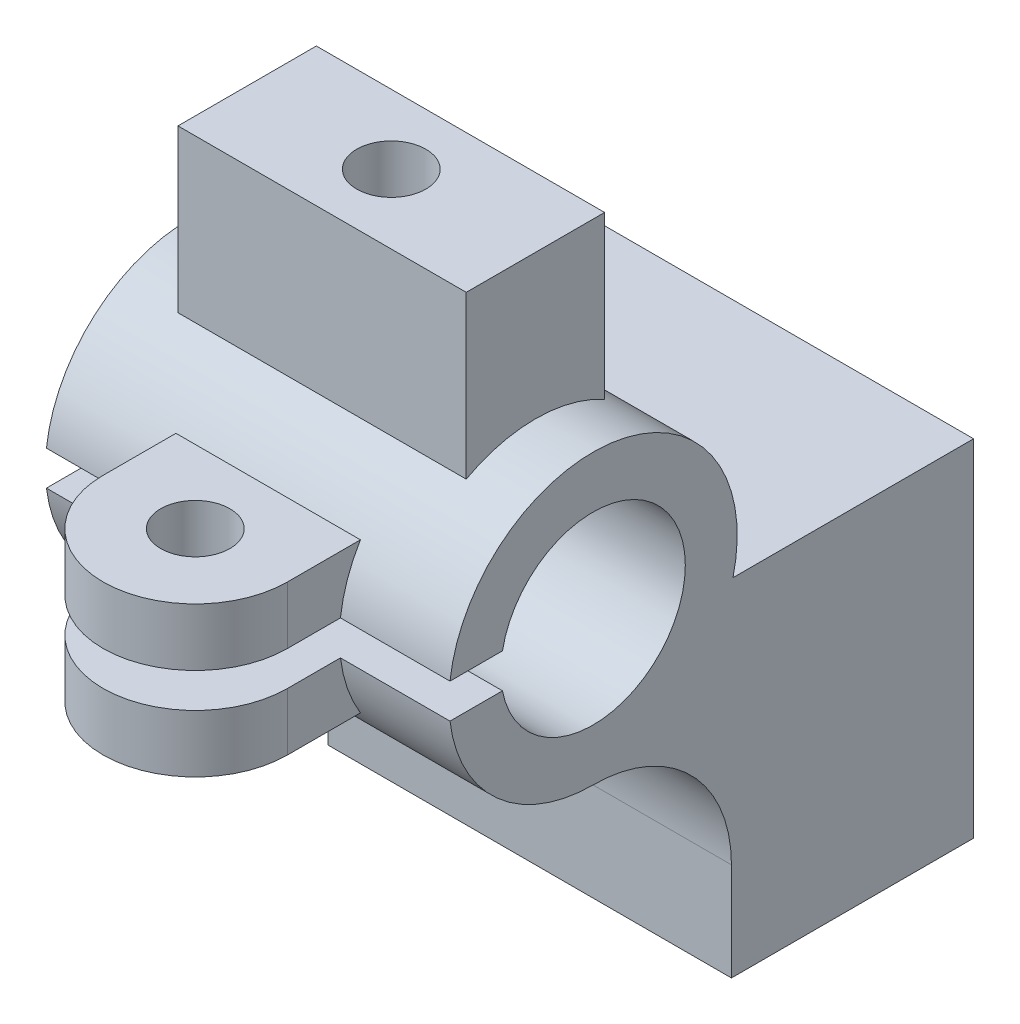
from build123d import *

# Parameters (mm, degrees)
BOSS_EXTRUDE1_DEPTH       = 17.5
BOSS_EXTRUDE2_DEPTH       = 12.5
BOSS_EXTRUDE3_DEPTH       = 8
FILLET1_RADIUS            = 8
FILLET1_LENGTH            = 5
FILLET2_RADIUS            = 8
FILLET2_LENGTH            = 5
F_6_0MM_DOWEL_HOLE1_D     = 6
F_6_0MM_DOWEL_HOLE1_DEPTH = 21.06015
F_6_0MM_DOWEL_HOLE2_D     = 6
F_6_0MM_DOWEL_HOLE2_DEPTH = 12


with BuildPart() as part:
    # Sketch1 → Boss-Extrude1 (new, symmetric)
    with BuildSketch(Plane(origin=(0, 0, 0), x_dir=(0, 0, -1), z_dir=(1, 0, 0))):
        with BuildLine():
            Line((-7.858116823, -1.5), (-12.409673646, -1.5))
            ThreePointArc((-12.409673646, -1.5), (-8.291561976, -9.354143467), (0, -12.5))
            ThreePointArc((0, -12.5), (8.485281374, -16.014718626), (12, -24.5))
            Line((12, -24.5), (12, -33))
            Line((12, -33), (33, -33))
            Line((33, -33), (33, -3))
            Line((33, -3), (12.1346611, -3))
            ThreePointArc((12.1346611, -3), (2.254197856, 12.295063726), (-12.409673646, 1.5))
            Line((-12.409673646, 1.5), (-7.858116823, 1.5))
            ThreePointArc((-7.858116823, 1.5), (8, 0), (-7.858116823, -1.5))
        make_face()
    extrude(amount=BOSS_EXTRUDE1_DEPTH, both=True)

    # Sketch1<3> → Boss-Extrude2 (add, symmetric)
    with BuildSketch(Plane(origin=(0, 0, 0), x_dir=(0, 0, -1), z_dir=(1, 0, 0))):
        with BuildLine():
            ThreePointArc((-6, 10.9658561), (0, 12.5), (6, 10.9658561))
            Line((6, 10.9658561), (6, 25))
            Line((6, 25), (-6, 25))
            Line((-6, 25), (-6, 10.9658561))
        make_face()
    extrude(amount=BOSS_EXTRUDE2_DEPTH, both=True)

    # Sketch1<4> → Boss-Extrude3 (add, symmetric)
    with BuildSketch(Plane(origin=(0, 0, 0), x_dir=(0, 0, -1), z_dir=(1, 0, 0))):
        with BuildLine():
            ThreePointArc((-12.409673646, 1.5), (-11.810991842, 4.092734013), (-10.677078252, 6.5))
            Line((-10.677078252, 6.5), (-25, 6.5))
            Line((-25, 6.5), (-25, 1.5))
            Line((-25, 1.5), (-12.409673646, 1.5))
        make_face()
        with BuildLine():
            Line((-25, -6.5), (-10.677078252, -6.5))
            ThreePointArc((-10.677078252, -6.5), (-11.810991842, -4.092734013), (-12.409673646, -1.5))
            Line((-12.409673646, -1.5), (-25, -1.5))
            Line((-25, -1.5), (-25, -6.5))
        make_face()
    extrude(amount=BOSS_EXTRUDE3_DEPTH, both=True)

    # Fillet1: full round fillet: the end face becomes a half cylinder, R = half its width
    fillet1_face = Plane((0, 4, 25), x_dir=(0, 1, 0), z_dir=(0, 0, 1))  # on the end face: x along it, z out of the body
    fillet1_slab = fillet1_face.offset(-FILLET1_RADIUS / 2) * Box(FILLET1_LENGTH, 2 * FILLET1_RADIUS, FILLET1_RADIUS, mode=Mode.PRIVATE)  # the body's end, R deep
    fillet1_round = Plane((0, 4, 17), x_dir=(0, 0, 1), z_dir=(0, 1, 0)) * Cylinder(FILLET1_RADIUS, FILLET1_LENGTH, mode=Mode.PRIVATE)  # its axis R under the face
    add(fillet1_slab - fillet1_round, mode=Mode.SUBTRACT)

    # Fillet2: full round fillet: the end face becomes a half cylinder, R = half its width
    fillet2_face = Plane((0, -4, 25), x_dir=(0, -1, 0), z_dir=(0, 0, 1))  # on the end face: x along it, z out of the body
    fillet2_slab = fillet2_face.offset(-FILLET2_RADIUS / 2) * Box(FILLET2_LENGTH, 2 * FILLET2_RADIUS, FILLET2_RADIUS, mode=Mode.PRIVATE)  # the body's end, R deep
    fillet2_round = Plane((0, -4, 17), x_dir=(0, 0, 1), z_dir=(0, -1, 0)) * Cylinder(FILLET2_RADIUS, FILLET2_LENGTH, mode=Mode.PRIVATE)  # its axis R under the face
    add(fillet2_slab - fillet2_round, mode=Mode.SUBTRACT)

    # Ø6.0mm Dowel Hole1
    with Locations(Plane(origin=(0, 6.5, 17), x_dir=(0, 0, 1), z_dir=(0, 1, 0))):
        with Locations((0, 0)):
            Hole(F_6_0MM_DOWEL_HOLE1_D / 2, depth=F_6_0MM_DOWEL_HOLE1_DEPTH)

    # Ø6.0mm Dowel Hole2
    with Locations(Plane.ZX.offset(25)):
        with Locations((0, 0)):
            Hole(F_6_0MM_DOWEL_HOLE2_D / 2, depth=F_6_0MM_DOWEL_HOLE2_DEPTH)


solid = part.part
